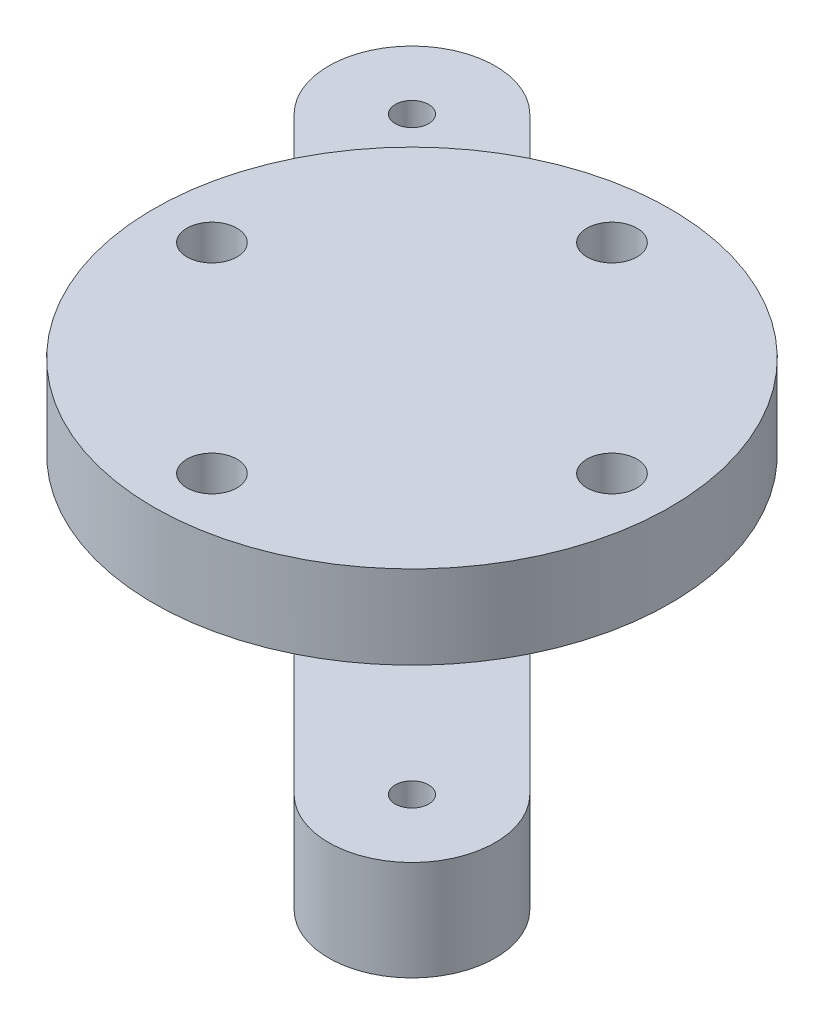
from build123d import *

# Parameters (mm, degrees)
SKETCH1_R           = 31
BOSS_EXTRUDE1_DEPTH = 10
SKETCH2_R           = 3
CUT_EXTRUDE11_DEPTH = 10
SKETCH5_R           = 5
CUT_EXTRUDE14_DEPTH = 5
SKETCH6_R           = 2
BOSS_EXTRUDE5_DEPTH = 12


with BuildPart() as part:
    # Sketch1 → Boss-Extrude1 (new body)
    with BuildSketch(Plane(origin=(0, 0, 0), x_dir=(1, 0, 0), z_dir=(0, 1, 0))):
        with Locations(Location((0, 0, 0), (0, 0, 270))):
            Circle(SKETCH1_R)
    extrude(amount=BOSS_EXTRUDE1_DEPTH)

    # Sketch2 → Cut-Extrude11 (cut)
    with BuildSketch(Plane(origin=(0, 10, 0), x_dir=(1, 0, 0), z_dir=(0, 1, 0))):
        with Locations(Location((0, 24, 0), (0, 0, 270))):
            Circle(SKETCH2_R)
        with Locations(Location((24, 0, 0), (0, 0, 270))):
            Circle(SKETCH2_R)
        with Locations(Location((0, -24, 0), (0, 0, 270))):
            Circle(SKETCH2_R)
        with Locations(Location((-24, 0, 0), (0, 0, 270))):
            Circle(SKETCH2_R)
    extrude(amount=-CUT_EXTRUDE11_DEPTH, mode=Mode.SUBTRACT)

    # Sketch5 → Cut-Extrude14 (cut)
    with BuildSketch(Plane(origin=(0, 0, 0), x_dir=(1, 0, 0), z_dir=(0, 1, 0))):
        with Locations(Location((0, 24, 0), (0, 0, 270))):
            Circle(SKETCH5_R)
        with Locations(Location((24, 0, 0), (0, 0, 270))):
            Circle(SKETCH5_R)
        with Locations(Location((0, -24, 0), (0, 0, 270))):
            Circle(SKETCH5_R)
        with Locations(Location((-24, 0, 0), (0, 0, 270))):
            Circle(SKETCH5_R)
    extrude(amount=CUT_EXTRUDE14_DEPTH, mode=Mode.SUBTRACT)

    # Sketch6 → Boss-Extrude5 (add)
    with BuildSketch(Plane(origin=(0, 0, 0), x_dir=(1, 0, 0), z_dir=(0, 1, 0))):
        with BuildLine():
            Line((28.284271247, -42.426406871), (-42.426406871, 28.284271247))
            ThreePointArc((-42.426406871, 28.284271247), (-42.426406871, 42.426406871), (-28.284271247, 42.426406871))
            Line((-28.284271247, 42.426406871), (42.426406871, -28.284271247))
            ThreePointArc((42.426406871, -28.284271247), (42.426406871, -42.426406871), (28.284271247, -42.426406871))
        make_face()
        with Locations(Location((-35.355339059, 35.355339059, 0), (0, 0, 270))):
            Circle(SKETCH6_R, mode=Mode.SUBTRACT)
        with Locations(Location((35.355339059, -35.355339059, 0), (0, 0, 270))):
            Circle(SKETCH6_R, mode=Mode.SUBTRACT)
    extrude(amount=-BOSS_EXTRUDE5_DEPTH)


solid = part.part
